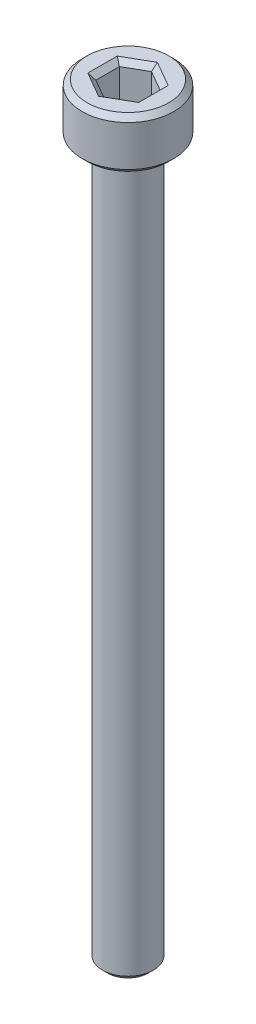
from build123d import *

# Parameters (mm, degrees)
SKETCH_1_R          = 2.25
EXTRUDE_1_DEPTH     = 2.5
CUT_EXTRUDE_1_DEPTH = 2
SKETCH_3_R          = 1.25
EXTRUDE_2_DEPTH     = 35
CHAMFER_1_SIZE      = 0.25


with BuildPart() as part:
    # 草图1 → 凸台-拉伸1 (new body)
    with BuildSketch(Plane(origin=(0, 0, 0), x_dir=(1, 0, 0), z_dir=(0, 1, 0))):
        with Locations(Location((0, 0, 0), (0, 0, 270))):
            Circle(SKETCH_1_R)
    extrude(amount=EXTRUDE_1_DEPTH)

    # 草图2 → 切除-拉伸1 (cut)
    with BuildSketch(Plane(origin=(0, 2.5, 0), x_dir=(1, 0, 0), z_dir=(0, 1, 0))):
        Polygon((0, 1.154700538), (-1, 0.577350269), (-1, -0.577350269), (0, -1.154700538), (1, -0.577350269), (1, 0.577350269), align=None)
    extrude(amount=-CUT_EXTRUDE_1_DEPTH, mode=Mode.SUBTRACT)

    # 草图3 → 凸台-拉伸2 (add)
    with BuildSketch(Plane.XZ):
        with Locations(Location((0, 0, 0), (0, 0, 270))):
            Circle(SKETCH_3_R)
    extrude(amount=EXTRUDE_2_DEPTH)

    # 倒角1
    chamfer_1_edges = [part.edges().sort_by_distance(p)[0] for p in [
        (0.5, 2.5, -0.866025404),
        (-0.5, 2.5, -0.866025404),
        (-1, 2.5, 0),
        (-0.5, 2.5, 0.866025404),
        (0.5, 2.5, 0.866025404),
        (1, 2.5, 0),
        (0, 0, -2.25),
        (0, -35, 1.25),
        (0, 2.5, -2.25),
    ]]
    chamfer(chamfer_1_edges, length=CHAMFER_1_SIZE)


solid = part.part
